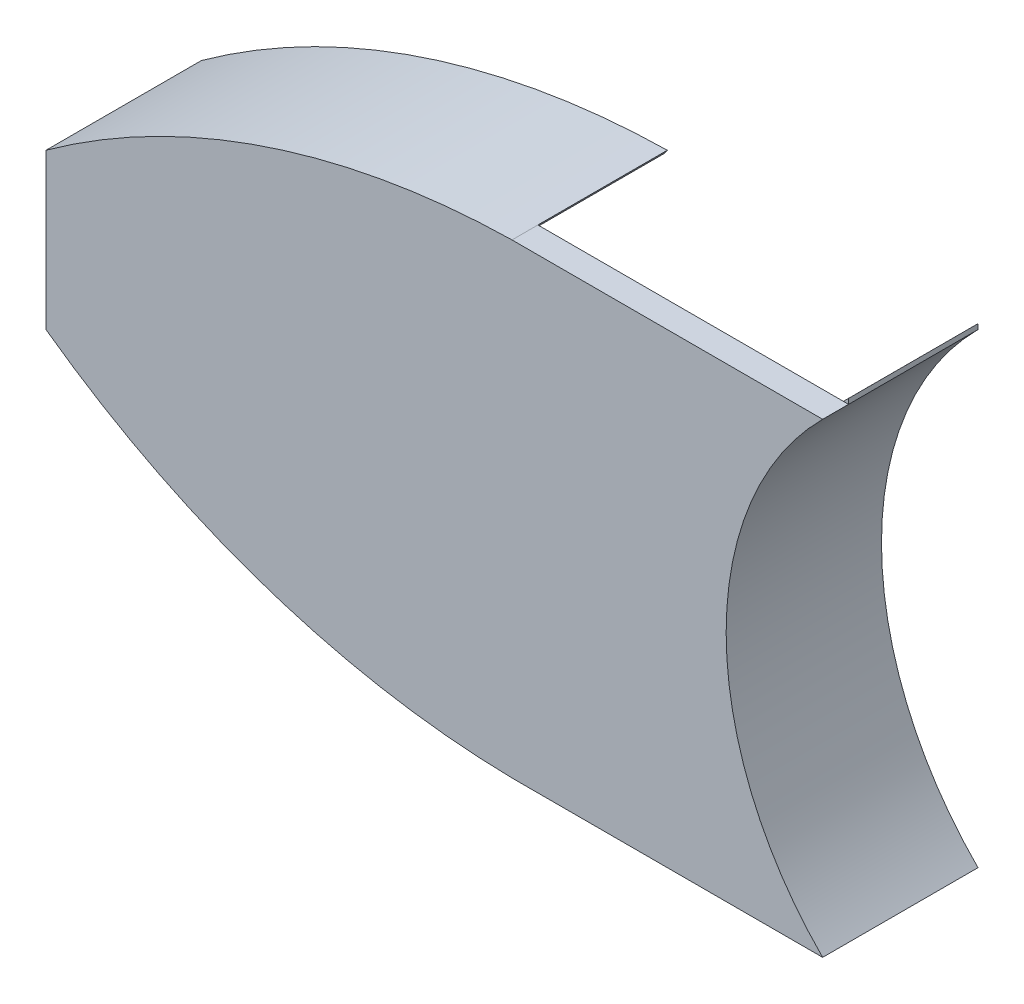
from build123d import *

# Parameters (mm, degrees)
BOSS_EXTRUDE1_DEPTH = 10
SKETCH3_W           = 50
SKETCH3_H           = 2
SKETCH4_W           = 50
SKETCH4_H           = 2


with BuildPart() as part:
    # Sketch1 → Boss-Extrude1 (new body)
    with BuildSketch(Plane.XY):
        with BuildLine():
            Line((0, 0), (-120, 0))
            ThreePointArc((-120, 0), (-214.59995491, 16.200135269), (-300, 60))
            Line((-300, 60), (-300, 120))
            ThreePointArc((-300, 120), (-214.59995491, 163.799864731), (-120, 180))
            Line((-120, 180), (0, 180))
            ThreePointArc((0, 180), (-37.279220614, 90), (0, 0))
        make_face()
    extrude(amount=BOSS_EXTRUDE1_DEPTH)

    # Sweep2: sweep along a curve in space
    with BuildLine() as sweep2_path:
        ThreePointArc((0, 0, 0), (-37.279220614, 90, 0), (0, 180, 0))
    # 3DSketch2 → Sweep2 (sweep)
    with BuildSketch(Plane(origin=(0, 0, 0), x_dir=(-0.03996803834887158, 0, -0.9992009587217895), z_dir=(0, -1, 0))):
        Polygon((0, 0), (49.960047936, 1.998401917), (50.039984013, 0), (0.079936077, -1.998401917), align=None)
    sweep(path=sweep2_path.line)

    # Sweep3: sweep along a curve in space
    with BuildLine() as sweep3_path:
        ThreePointArc((-300, 60, 0), (-214.59995491, 16.200135269, 0), (-120, 0, 0))
    # Sketch3 → Sweep3 (sweep)
    with BuildSketch(Plane.ZY.offset(300)):
        with Locations((-25, 61)):
            Rectangle(SKETCH3_W, SKETCH3_H)
    sweep(path=sweep3_path.line)

    # Sweep4: sweep along a curve in space
    with BuildLine() as sweep4_path:
        ThreePointArc((-120, 180, 0), (-214.59995491, 163.799864731, 0), (-300, 120, 0))
    # Sketch4 → Sweep4 (sweep)
    with BuildSketch(Plane.ZY.offset(300)):
        with Locations((-25, 119)):
            Rectangle(SKETCH4_W, SKETCH4_H)
    sweep(path=sweep4_path.line)


solid = part.part
